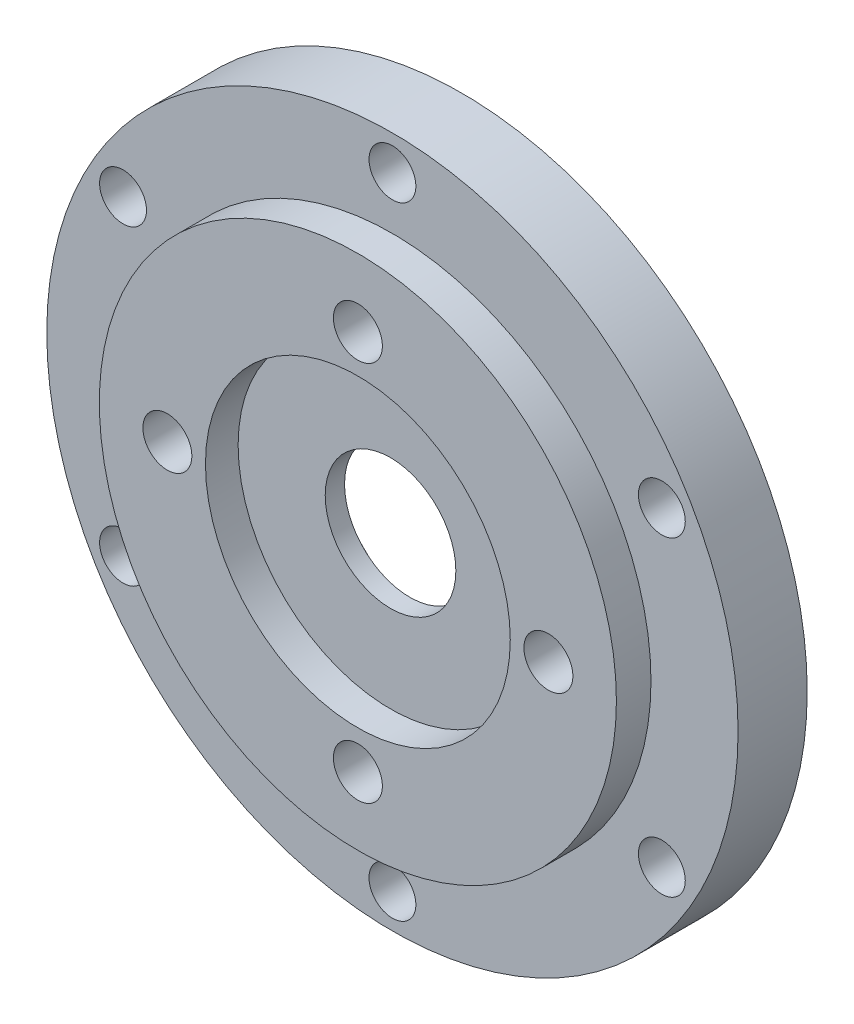
from build123d import *

# Parameters (mm, degrees)
SKETCH1_R                      = 31.75
BOSS_EXTRUDE1_DEPTH            = 9.525
SKETCH2_R                      = 14
CUT_EXTRUDE1_DEPTH             = 3
F_8_CLEARANCE_HOLE1_D          = 4.3053
SKETCH5_R                      = 12.7
CUT_EXTRUDE2_DEPTH             = 4.7498
SKETCH6_R                      = 6
CUT_EXTRUDE3_DEPTH             = 46.154485215
CBORE_FOR_M4_SHCS1_D           = 4.5
CBORE_FOR_M4_SHCS1_CBORE_D     = 8
CBORE_FOR_M4_SHCS1_CBORE_DEPTH = 4
SKETCH9_OUTSIDE_W              = 83.562
SKETCH9_OUTSIDE_H              = 83.562
SKETCH9_OUTSIDE_R              = 23.749
CUT_EXTRUDE4_DEPTH             = 3.175


with BuildPart() as part:
    # Sketch1 → Boss-Extrude1 (new body)
    with BuildSketch(Plane.XY):
        with Locations(Location((0, 0, 0), (0, 0, 180))):
            Circle(SKETCH1_R)
    extrude(amount=BOSS_EXTRUDE1_DEPTH)

    # Sketch2 → Cut-Extrude1 (cut)
    with BuildSketch(Plane.XY.offset(9.525)):
        Circle(SKETCH2_R)
    extrude(amount=-CUT_EXTRUDE1_DEPTH, mode=Mode.SUBTRACT)

    # #8 Clearance Hole1 (through all)
    with Locations(Plane.XY.offset(9.525)):
        with Locations((0, 28.575), (24.746675913, 14.2875), (24.746675913, -14.2875), (0, -28.575), (-24.746675913, -14.2875), (-24.746675913, 14.2875)):
            Hole(F_8_CLEARANCE_HOLE1_D / 2)

    # Sketch5 → Cut-Extrude2 (cut)
    with BuildSketch(Plane(origin=(0, 0, 0), x_dir=(-1, 0, 0), z_dir=(0, 0, -1))):
        Circle(SKETCH5_R)
    extrude(amount=-CUT_EXTRUDE2_DEPTH, mode=Mode.SUBTRACT)

    # Sketch6 → Cut-Extrude3 (cut, through all)
    with BuildSketch(Plane(origin=(0, 0, 4.7498), x_dir=(-1, 0, 0), z_dir=(0, 0, -1))):
        Circle(SKETCH6_R)
    extrude(amount=-CUT_EXTRUDE3_DEPTH, mode=Mode.SUBTRACT)

    # CBORE for M4 SHCS1 (through all)
    with Locations(Plane(origin=(0, 0, 0), x_dir=(-1, 0, 0), z_dir=(0, 0, -1))):
        with Locations((0, 17.5), (17.5, 0), (0, -17.5), (-17.5, 0)):
            CounterBoreHole(CBORE_FOR_M4_SHCS1_D / 2, CBORE_FOR_M4_SHCS1_CBORE_D / 2, CBORE_FOR_M4_SHCS1_CBORE_DEPTH)

    # Sketch9 outside → Cut-Extrude4 (cut)
    with BuildSketch(Plane.XY.offset(9.525)):
        Rectangle(SKETCH9_OUTSIDE_W, SKETCH9_OUTSIDE_H)
        Circle(SKETCH9_OUTSIDE_R, mode=Mode.SUBTRACT)
    extrude(amount=-CUT_EXTRUDE4_DEPTH, mode=Mode.SUBTRACT)


solid = part.part
